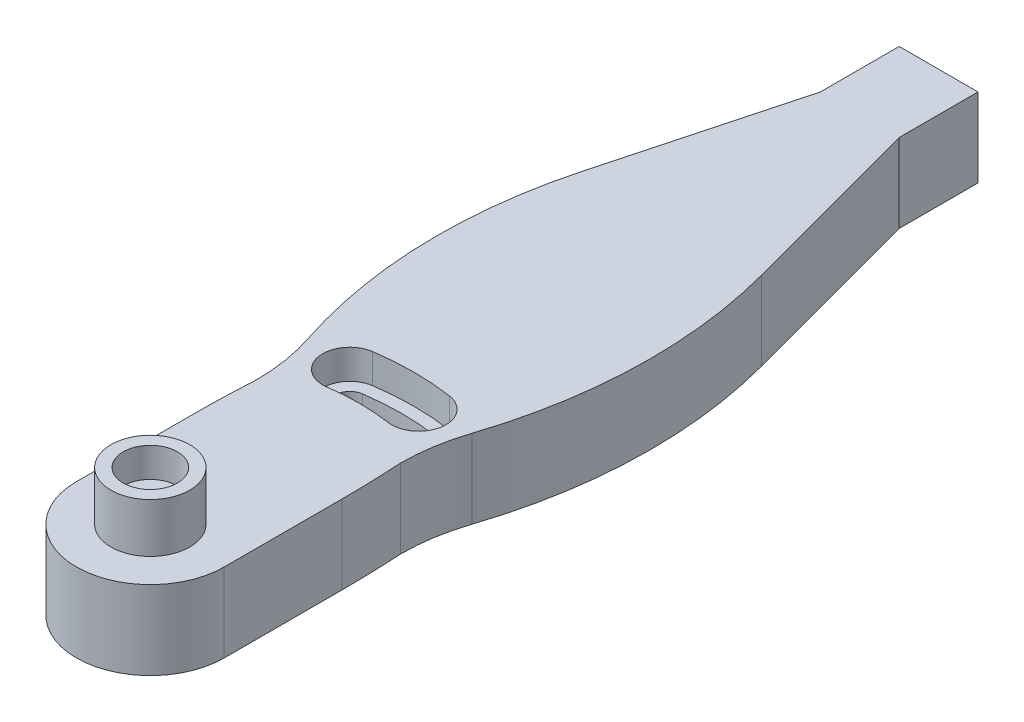
from build123d import *

# Parameters (mm, degrees)
SKETCH1_R           = 1.5
BOSS_EXTRUDE1_DEPTH = 8
SKETCH2_R           = 4
SKETCH2_R_2         = 1.5
BOSS_EXTRUDE2_DEPTH = 2
SKETCH3_R           = 4
SKETCH3_R_2         = 2.75
BOSS_EXTRUDE3_DEPTH = 3
CUT_EXTRUDE1_DEPTH  = 3


with BuildPart() as part:
    # Sketch1 → Boss-Extrude1 (new body)
    with BuildSketch(Plane(origin=(0, 0, 0), x_dir=(1, 0, 0), z_dir=(0, 1, 0))):
        with BuildLine():
            Line((-7.5, 11.932713059), (-7.5, 0))
            ThreePointArc((-7.5, 0), (0, -7.5), (7.5, 0))
            Line((7.5, 0), (7.5, 11.932713059))
            ThreePointArc((7.5, 11.932713059), (7.452991921, 14.998558127), (7.31201188, 18.061520806))
            ThreePointArc((7.31201188, 18.061520806), (7.564401673, 21.22883688), (8.315200992, 24.31621313))
            ThreePointArc((8.315200992, 24.31621313), (10.803384698, 38.546346738), (9.119465085, 52.893896195))
            Line((9.119465085, 52.893896195), (4, 72))
            Line((4, 72), (4, 80))
            Line((4, 80), (-4, 80))
            Line((-4, 80), (-4, 72))
            Line((-4, 72), (-9.119465085, 52.893896195))
            ThreePointArc((-9.119465085, 52.893896195), (-10.803384698, 38.546346738), (-8.315200992, 24.31621313))
            ThreePointArc((-8.315200992, 24.31621313), (-7.564401673, 21.22883688), (-7.31201188, 18.061520806))
            ThreePointArc((-7.31201188, 18.061520806), (-7.452991921, 14.998558127), (-7.5, 11.932713059))
        make_face()
        with Locations(Location((0, 0, 0), (0, 0, 270))):
            Circle(SKETCH1_R, mode=Mode.SUBTRACT)
        with BuildLine():
            ThreePointArc((-3.28125, 22.259456382), (-4.983963759, 23.524670141), (-3.71875, 25.2273839))
            ThreePointArc((-3.71875, 25.2273839), (0, 25.5), (3.71875, 25.2273839))
            ThreePointArc((3.71875, 25.2273839), (4.983963759, 23.524670141), (3.28125, 22.259456382))
            ThreePointArc((3.28125, 22.259456382), (0, 22.5), (-3.28125, 22.259456382))
        make_face(mode=Mode.SUBTRACT)
    extrude(amount=BOSS_EXTRUDE1_DEPTH)

    # Sketch2 → Boss-Extrude2 (add)
    with BuildSketch(Plane(origin=(0, 8, 0), x_dir=(1, 0, 0), z_dir=(0, 1, 0))):
        with Locations(Location((0, 0, 0), (0, 0, 270))):
            Circle(SKETCH2_R)
        with Locations(Location((0, 0, 0), (0, 0, 270))):
            Circle(SKETCH2_R_2, mode=Mode.SUBTRACT)
    extrude(amount=BOSS_EXTRUDE2_DEPTH)

    # Sketch3 → Boss-Extrude3 (add)
    with BuildSketch(Plane(origin=(0, 10, 0), x_dir=(1, 0, 0), z_dir=(0, 1, 0))):
        with Locations(Location((0, 0, 0), (0, 0, 270))):
            Circle(SKETCH3_R)
        with Locations(Location((0, 0, 0), (0, 0, 270))):
            Circle(SKETCH3_R_2, mode=Mode.SUBTRACT)
    extrude(amount=BOSS_EXTRUDE3_DEPTH)

    # Sketch4 → Cut-Extrude1 (cut)
    with BuildSketch(Plane(origin=(0, 8, 0), x_dir=(1, 0, 0), z_dir=(0, 1, 0))):
        with BuildLine():
            ThreePointArc((3.098958333, 21.022819917), (6.220600225, 23.342378475), (3.901041667, 26.464020366))
            ThreePointArc((3.901041667, 26.464020366), (0, 26.75), (-3.901041667, 26.464020366))
            ThreePointArc((-3.901041667, 26.464020366), (-6.220600225, 23.342378475), (-3.098958333, 21.022819917))
            ThreePointArc((-3.098958333, 21.022819917), (0, 21.25), (3.098958333, 21.022819917))
        make_face()
    extrude(amount=-CUT_EXTRUDE1_DEPTH, mode=Mode.SUBTRACT)


solid = part.part
